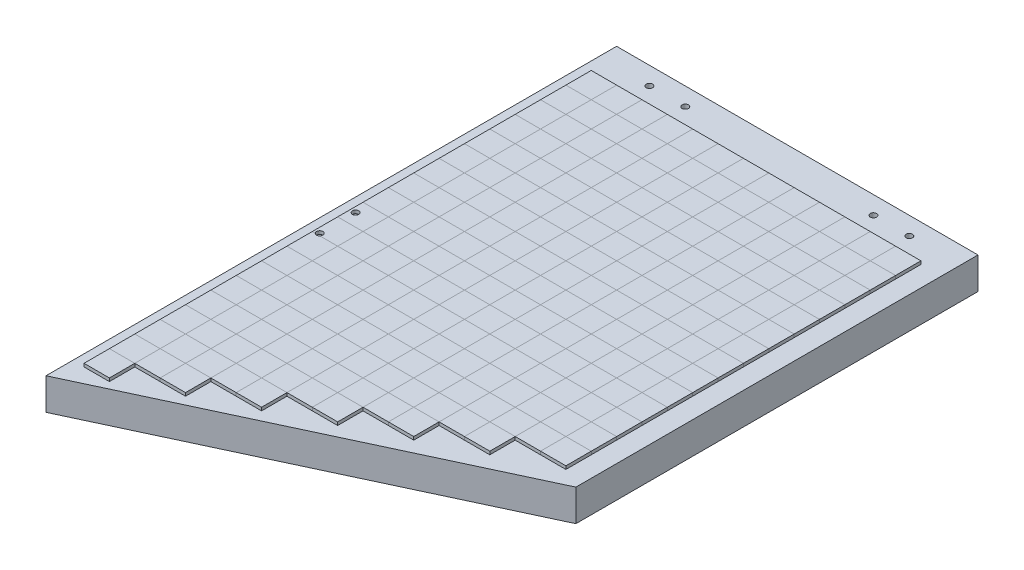
from build123d import *

# Parameters (mm, degrees)
BOSS_EXTRUDE1_DEPTH  = 63.5
SKETCH8_W            = 50.8
SKETCH8_H            = 50.8
BOSS_EXTRUDE2_DEPTH  = 6.35
LPATTERN1_COUNT      = 13
LPATTERN1_PITCH      = 50.8
LPATTERN1_COUNT_DIR2 = 20
LPATTERN1_PITCH_DIR2 = 50.8
CUT_EXTRUDE1_DEPTH   = 1205.933472064
CUT_EXTRUDE3_DEPTH   = 6.35
SKETCH13_R           = 6.35
CUT_EXTRUDE4_DEPTH   = 1205.933472064
SKETCH6_R            = 6.35
CUT_EXTRUDE5_DEPTH   = 1205.568653751


with BuildPart() as part:
    # Sketch1 → Boss-Extrude1 (new body)
    with BuildSketch(Plane(origin=(0, 0, 0), x_dir=(1, 0, 0), z_dir=(0, 1, 0))):
        Polygon((-349.5, 0), (374.4, 0), (374.4, -805.439886262), (-349.5, -1143), align=None)
    extrude(amount=BOSS_EXTRUDE1_DEPTH)


with BuildPart() as body_2:
    # Sketch8 → Boss-Extrude2 (new body)
    with BuildSketch(Plane(origin=(0, 66.04, 0), x_dir=(1, 0, 0), z_dir=(0, 1, 0))):
        with Locations((-298.7, -101.6)):
            Rectangle(SKETCH8_W, SKETCH8_H)
    boss_extrude2 = extrude(amount=BOSS_EXTRUDE2_DEPTH)


with BuildPart() as lpattern1_1:
    # LPattern1: pattern copy
    add(boss_extrude2.moved(Location(Vector(1, 0, 0) * (0 * LPATTERN1_PITCH) + Vector(0, 0, 1) * (1 * LPATTERN1_PITCH_DIR2))))


with BuildPart() as lpattern1_2:
    # LPattern1: pattern copy
    add(boss_extrude2.moved(Location(Vector(1, 0, 0) * (0 * LPATTERN1_PITCH) + Vector(0, 0, 1) * (2 * LPATTERN1_PITCH_DIR2))))


with BuildPart() as lpattern1_3:
    # LPattern1: pattern copy
    add(boss_extrude2.moved(Location(Vector(1, 0, 0) * (0 * LPATTERN1_PITCH) + Vector(0, 0, 1) * (3 * LPATTERN1_PITCH_DIR2))))


with BuildPart() as lpattern1_4:
    # LPattern1: pattern copy
    add(boss_extrude2.moved(Location(Vector(1, 0, 0) * (0 * LPATTERN1_PITCH) + Vector(0, 0, 1) * (4 * LPATTERN1_PITCH_DIR2))))


with BuildPart() as lpattern1_5:
    # LPattern1: pattern copy
    add(boss_extrude2.moved(Location(Vector(1, 0, 0) * (0 * LPATTERN1_PITCH) + Vector(0, 0, 1) * (5 * LPATTERN1_PITCH_DIR2))))


with BuildPart() as lpattern1_6:
    # LPattern1: pattern copy
    add(boss_extrude2.moved(Location(Vector(1, 0, 0) * (0 * LPATTERN1_PITCH) + Vector(0, 0, 1) * (6 * LPATTERN1_PITCH_DIR2))))


with BuildPart() as lpattern1_7:
    # LPattern1: pattern copy
    add(boss_extrude2.moved(Location(Vector(1, 0, 0) * (0 * LPATTERN1_PITCH) + Vector(0, 0, 1) * (7 * LPATTERN1_PITCH_DIR2))))


with BuildPart() as lpattern1_8:
    # LPattern1: pattern copy
    add(boss_extrude2.moved(Location(Vector(1, 0, 0) * (0 * LPATTERN1_PITCH) + Vector(0, 0, 1) * (8 * LPATTERN1_PITCH_DIR2))))


with BuildPart() as lpattern1_9:
    # LPattern1: pattern copy
    add(boss_extrude2.moved(Location(Vector(1, 0, 0) * (0 * LPATTERN1_PITCH) + Vector(0, 0, 1) * (9 * LPATTERN1_PITCH_DIR2))))


with BuildPart() as lpattern1_10:
    # LPattern1: pattern copy
    add(boss_extrude2.moved(Location(Vector(1, 0, 0) * (0 * LPATTERN1_PITCH) + Vector(0, 0, 1) * (10 * LPATTERN1_PITCH_DIR2))))


with BuildPart() as lpattern1_11:
    # LPattern1: pattern copy
    add(boss_extrude2.moved(Location(Vector(1, 0, 0) * (0 * LPATTERN1_PITCH) + Vector(0, 0, 1) * (11 * LPATTERN1_PITCH_DIR2))))


with BuildPart() as lpattern1_12:
    # LPattern1: pattern copy
    add(boss_extrude2.moved(Location(Vector(1, 0, 0) * (0 * LPATTERN1_PITCH) + Vector(0, 0, 1) * (12 * LPATTERN1_PITCH_DIR2))))


with BuildPart() as lpattern1_13:
    # LPattern1: pattern copy
    add(boss_extrude2.moved(Location(Vector(1, 0, 0) * (0 * LPATTERN1_PITCH) + Vector(0, 0, 1) * (13 * LPATTERN1_PITCH_DIR2))))


with BuildPart() as lpattern1_14:
    # LPattern1: pattern copy
    add(boss_extrude2.moved(Location(Vector(1, 0, 0) * (0 * LPATTERN1_PITCH) + Vector(0, 0, 1) * (14 * LPATTERN1_PITCH_DIR2))))


with BuildPart() as lpattern1_15:
    # LPattern1: pattern copy
    add(boss_extrude2.moved(Location(Vector(1, 0, 0) * (0 * LPATTERN1_PITCH) + Vector(0, 0, 1) * (15 * LPATTERN1_PITCH_DIR2))))


with BuildPart() as lpattern1_16:
    # LPattern1: pattern copy
    add(boss_extrude2.moved(Location(Vector(1, 0, 0) * (0 * LPATTERN1_PITCH) + Vector(0, 0, 1) * (16 * LPATTERN1_PITCH_DIR2))))


with BuildPart() as lpattern1_17:
    # LPattern1: pattern copy
    add(boss_extrude2.moved(Location(Vector(1, 0, 0) * (0 * LPATTERN1_PITCH) + Vector(0, 0, 1) * (17 * LPATTERN1_PITCH_DIR2))))


with BuildPart() as lpattern1_18:
    # LPattern1: pattern copy
    add(boss_extrude2.moved(Location(Vector(1, 0, 0) * (0 * LPATTERN1_PITCH) + Vector(0, 0, 1) * (18 * LPATTERN1_PITCH_DIR2))))


with BuildPart() as lpattern1_19:
    # LPattern1: pattern copy
    add(boss_extrude2.moved(Location(Vector(1, 0, 0) * (0 * LPATTERN1_PITCH) + Vector(0, 0, 1) * (19 * LPATTERN1_PITCH_DIR2))))


with BuildPart() as lpattern1_20:
    # LPattern1: pattern copy
    add(boss_extrude2.moved(Location(Vector(1, 0, 0) * (1 * LPATTERN1_PITCH) + Vector(0, 0, 1) * (0 * LPATTERN1_PITCH_DIR2))))


with BuildPart() as lpattern1_21:
    # LPattern1: pattern copy
    add(boss_extrude2.moved(Location(Vector(1, 0, 0) * (1 * LPATTERN1_PITCH) + Vector(0, 0, 1) * (1 * LPATTERN1_PITCH_DIR2))))


with BuildPart() as lpattern1_22:
    # LPattern1: pattern copy
    add(boss_extrude2.moved(Location(Vector(1, 0, 0) * (1 * LPATTERN1_PITCH) + Vector(0, 0, 1) * (2 * LPATTERN1_PITCH_DIR2))))


with BuildPart() as lpattern1_23:
    # LPattern1: pattern copy
    add(boss_extrude2.moved(Location(Vector(1, 0, 0) * (1 * LPATTERN1_PITCH) + Vector(0, 0, 1) * (3 * LPATTERN1_PITCH_DIR2))))


with BuildPart() as lpattern1_24:
    # LPattern1: pattern copy
    add(boss_extrude2.moved(Location(Vector(1, 0, 0) * (1 * LPATTERN1_PITCH) + Vector(0, 0, 1) * (4 * LPATTERN1_PITCH_DIR2))))


with BuildPart() as lpattern1_25:
    # LPattern1: pattern copy
    add(boss_extrude2.moved(Location(Vector(1, 0, 0) * (1 * LPATTERN1_PITCH) + Vector(0, 0, 1) * (5 * LPATTERN1_PITCH_DIR2))))


with BuildPart() as lpattern1_26:
    # LPattern1: pattern copy
    add(boss_extrude2.moved(Location(Vector(1, 0, 0) * (1 * LPATTERN1_PITCH) + Vector(0, 0, 1) * (6 * LPATTERN1_PITCH_DIR2))))


with BuildPart() as lpattern1_27:
    # LPattern1: pattern copy
    add(boss_extrude2.moved(Location(Vector(1, 0, 0) * (1 * LPATTERN1_PITCH) + Vector(0, 0, 1) * (7 * LPATTERN1_PITCH_DIR2))))


with BuildPart() as lpattern1_28:
    # LPattern1: pattern copy
    add(boss_extrude2.moved(Location(Vector(1, 0, 0) * (1 * LPATTERN1_PITCH) + Vector(0, 0, 1) * (8 * LPATTERN1_PITCH_DIR2))))


with BuildPart() as lpattern1_29:
    # LPattern1: pattern copy
    add(boss_extrude2.moved(Location(Vector(1, 0, 0) * (1 * LPATTERN1_PITCH) + Vector(0, 0, 1) * (9 * LPATTERN1_PITCH_DIR2))))


with BuildPart() as lpattern1_30:
    # LPattern1: pattern copy
    add(boss_extrude2.moved(Location(Vector(1, 0, 0) * (1 * LPATTERN1_PITCH) + Vector(0, 0, 1) * (10 * LPATTERN1_PITCH_DIR2))))


with BuildPart() as lpattern1_31:
    # LPattern1: pattern copy
    add(boss_extrude2.moved(Location(Vector(1, 0, 0) * (1 * LPATTERN1_PITCH) + Vector(0, 0, 1) * (11 * LPATTERN1_PITCH_DIR2))))


with BuildPart() as lpattern1_32:
    # LPattern1: pattern copy
    add(boss_extrude2.moved(Location(Vector(1, 0, 0) * (1 * LPATTERN1_PITCH) + Vector(0, 0, 1) * (12 * LPATTERN1_PITCH_DIR2))))


with BuildPart() as lpattern1_33:
    # LPattern1: pattern copy
    add(boss_extrude2.moved(Location(Vector(1, 0, 0) * (1 * LPATTERN1_PITCH) + Vector(0, 0, 1) * (13 * LPATTERN1_PITCH_DIR2))))


with BuildPart() as lpattern1_34:
    # LPattern1: pattern copy
    add(boss_extrude2.moved(Location(Vector(1, 0, 0) * (1 * LPATTERN1_PITCH) + Vector(0, 0, 1) * (14 * LPATTERN1_PITCH_DIR2))))


with BuildPart() as lpattern1_35:
    # LPattern1: pattern copy
    add(boss_extrude2.moved(Location(Vector(1, 0, 0) * (1 * LPATTERN1_PITCH) + Vector(0, 0, 1) * (15 * LPATTERN1_PITCH_DIR2))))


with BuildPart() as lpattern1_36:
    # LPattern1: pattern copy
    add(boss_extrude2.moved(Location(Vector(1, 0, 0) * (1 * LPATTERN1_PITCH) + Vector(0, 0, 1) * (16 * LPATTERN1_PITCH_DIR2))))


with BuildPart() as lpattern1_37:
    # LPattern1: pattern copy
    add(boss_extrude2.moved(Location(Vector(1, 0, 0) * (1 * LPATTERN1_PITCH) + Vector(0, 0, 1) * (17 * LPATTERN1_PITCH_DIR2))))


with BuildPart() as lpattern1_38:
    # LPattern1: pattern copy
    add(boss_extrude2.moved(Location(Vector(1, 0, 0) * (1 * LPATTERN1_PITCH) + Vector(0, 0, 1) * (18 * LPATTERN1_PITCH_DIR2))))


with BuildPart() as lpattern1_39:
    # LPattern1: pattern copy
    add(boss_extrude2.moved(Location(Vector(1, 0, 0) * (1 * LPATTERN1_PITCH) + Vector(0, 0, 1) * (19 * LPATTERN1_PITCH_DIR2))))


with BuildPart() as lpattern1_40:
    # LPattern1: pattern copy
    add(boss_extrude2.moved(Location(Vector(1, 0, 0) * (2 * LPATTERN1_PITCH) + Vector(0, 0, 1) * (0 * LPATTERN1_PITCH_DIR2))))


with BuildPart() as lpattern1_41:
    # LPattern1: pattern copy
    add(boss_extrude2.moved(Location(Vector(1, 0, 0) * (2 * LPATTERN1_PITCH) + Vector(0, 0, 1) * (1 * LPATTERN1_PITCH_DIR2))))


with BuildPart() as lpattern1_42:
    # LPattern1: pattern copy
    add(boss_extrude2.moved(Location(Vector(1, 0, 0) * (2 * LPATTERN1_PITCH) + Vector(0, 0, 1) * (2 * LPATTERN1_PITCH_DIR2))))


with BuildPart() as lpattern1_43:
    # LPattern1: pattern copy
    add(boss_extrude2.moved(Location(Vector(1, 0, 0) * (2 * LPATTERN1_PITCH) + Vector(0, 0, 1) * (3 * LPATTERN1_PITCH_DIR2))))


with BuildPart() as lpattern1_44:
    # LPattern1: pattern copy
    add(boss_extrude2.moved(Location(Vector(1, 0, 0) * (2 * LPATTERN1_PITCH) + Vector(0, 0, 1) * (4 * LPATTERN1_PITCH_DIR2))))


with BuildPart() as lpattern1_45:
    # LPattern1: pattern copy
    add(boss_extrude2.moved(Location(Vector(1, 0, 0) * (2 * LPATTERN1_PITCH) + Vector(0, 0, 1) * (5 * LPATTERN1_PITCH_DIR2))))


with BuildPart() as lpattern1_46:
    # LPattern1: pattern copy
    add(boss_extrude2.moved(Location(Vector(1, 0, 0) * (2 * LPATTERN1_PITCH) + Vector(0, 0, 1) * (6 * LPATTERN1_PITCH_DIR2))))


with BuildPart() as lpattern1_47:
    # LPattern1: pattern copy
    add(boss_extrude2.moved(Location(Vector(1, 0, 0) * (2 * LPATTERN1_PITCH) + Vector(0, 0, 1) * (7 * LPATTERN1_PITCH_DIR2))))


with BuildPart() as lpattern1_48:
    # LPattern1: pattern copy
    add(boss_extrude2.moved(Location(Vector(1, 0, 0) * (2 * LPATTERN1_PITCH) + Vector(0, 0, 1) * (8 * LPATTERN1_PITCH_DIR2))))


with BuildPart() as lpattern1_49:
    # LPattern1: pattern copy
    add(boss_extrude2.moved(Location(Vector(1, 0, 0) * (2 * LPATTERN1_PITCH) + Vector(0, 0, 1) * (9 * LPATTERN1_PITCH_DIR2))))


with BuildPart() as lpattern1_50:
    # LPattern1: pattern copy
    add(boss_extrude2.moved(Location(Vector(1, 0, 0) * (2 * LPATTERN1_PITCH) + Vector(0, 0, 1) * (10 * LPATTERN1_PITCH_DIR2))))


with BuildPart() as lpattern1_51:
    # LPattern1: pattern copy
    add(boss_extrude2.moved(Location(Vector(1, 0, 0) * (2 * LPATTERN1_PITCH) + Vector(0, 0, 1) * (11 * LPATTERN1_PITCH_DIR2))))


with BuildPart() as lpattern1_52:
    # LPattern1: pattern copy
    add(boss_extrude2.moved(Location(Vector(1, 0, 0) * (2 * LPATTERN1_PITCH) + Vector(0, 0, 1) * (12 * LPATTERN1_PITCH_DIR2))))


with BuildPart() as lpattern1_53:
    # LPattern1: pattern copy
    add(boss_extrude2.moved(Location(Vector(1, 0, 0) * (2 * LPATTERN1_PITCH) + Vector(0, 0, 1) * (13 * LPATTERN1_PITCH_DIR2))))


with BuildPart() as lpattern1_54:
    # LPattern1: pattern copy
    add(boss_extrude2.moved(Location(Vector(1, 0, 0) * (2 * LPATTERN1_PITCH) + Vector(0, 0, 1) * (14 * LPATTERN1_PITCH_DIR2))))


with BuildPart() as lpattern1_55:
    # LPattern1: pattern copy
    add(boss_extrude2.moved(Location(Vector(1, 0, 0) * (2 * LPATTERN1_PITCH) + Vector(0, 0, 1) * (15 * LPATTERN1_PITCH_DIR2))))


with BuildPart() as lpattern1_56:
    # LPattern1: pattern copy
    add(boss_extrude2.moved(Location(Vector(1, 0, 0) * (2 * LPATTERN1_PITCH) + Vector(0, 0, 1) * (16 * LPATTERN1_PITCH_DIR2))))


with BuildPart() as lpattern1_57:
    # LPattern1: pattern copy
    add(boss_extrude2.moved(Location(Vector(1, 0, 0) * (2 * LPATTERN1_PITCH) + Vector(0, 0, 1) * (17 * LPATTERN1_PITCH_DIR2))))


with BuildPart() as lpattern1_58:
    # LPattern1: pattern copy
    add(boss_extrude2.moved(Location(Vector(1, 0, 0) * (2 * LPATTERN1_PITCH) + Vector(0, 0, 1) * (18 * LPATTERN1_PITCH_DIR2))))


with BuildPart() as lpattern1_59:
    # LPattern1: pattern copy
    add(boss_extrude2.moved(Location(Vector(1, 0, 0) * (2 * LPATTERN1_PITCH) + Vector(0, 0, 1) * (19 * LPATTERN1_PITCH_DIR2))))


with BuildPart() as lpattern1_60:
    # LPattern1: pattern copy
    add(boss_extrude2.moved(Location(Vector(1, 0, 0) * (3 * LPATTERN1_PITCH) + Vector(0, 0, 1) * (0 * LPATTERN1_PITCH_DIR2))))


with BuildPart() as lpattern1_61:
    # LPattern1: pattern copy
    add(boss_extrude2.moved(Location(Vector(1, 0, 0) * (3 * LPATTERN1_PITCH) + Vector(0, 0, 1) * (1 * LPATTERN1_PITCH_DIR2))))


with BuildPart() as lpattern1_62:
    # LPattern1: pattern copy
    add(boss_extrude2.moved(Location(Vector(1, 0, 0) * (3 * LPATTERN1_PITCH) + Vector(0, 0, 1) * (2 * LPATTERN1_PITCH_DIR2))))


with BuildPart() as lpattern1_63:
    # LPattern1: pattern copy
    add(boss_extrude2.moved(Location(Vector(1, 0, 0) * (3 * LPATTERN1_PITCH) + Vector(0, 0, 1) * (3 * LPATTERN1_PITCH_DIR2))))


with BuildPart() as lpattern1_64:
    # LPattern1: pattern copy
    add(boss_extrude2.moved(Location(Vector(1, 0, 0) * (3 * LPATTERN1_PITCH) + Vector(0, 0, 1) * (4 * LPATTERN1_PITCH_DIR2))))


with BuildPart() as lpattern1_65:
    # LPattern1: pattern copy
    add(boss_extrude2.moved(Location(Vector(1, 0, 0) * (3 * LPATTERN1_PITCH) + Vector(0, 0, 1) * (5 * LPATTERN1_PITCH_DIR2))))


with BuildPart() as lpattern1_66:
    # LPattern1: pattern copy
    add(boss_extrude2.moved(Location(Vector(1, 0, 0) * (3 * LPATTERN1_PITCH) + Vector(0, 0, 1) * (6 * LPATTERN1_PITCH_DIR2))))


with BuildPart() as lpattern1_67:
    # LPattern1: pattern copy
    add(boss_extrude2.moved(Location(Vector(1, 0, 0) * (3 * LPATTERN1_PITCH) + Vector(0, 0, 1) * (7 * LPATTERN1_PITCH_DIR2))))


with BuildPart() as lpattern1_68:
    # LPattern1: pattern copy
    add(boss_extrude2.moved(Location(Vector(1, 0, 0) * (3 * LPATTERN1_PITCH) + Vector(0, 0, 1) * (8 * LPATTERN1_PITCH_DIR2))))


with BuildPart() as lpattern1_69:
    # LPattern1: pattern copy
    add(boss_extrude2.moved(Location(Vector(1, 0, 0) * (3 * LPATTERN1_PITCH) + Vector(0, 0, 1) * (9 * LPATTERN1_PITCH_DIR2))))


with BuildPart() as lpattern1_70:
    # LPattern1: pattern copy
    add(boss_extrude2.moved(Location(Vector(1, 0, 0) * (3 * LPATTERN1_PITCH) + Vector(0, 0, 1) * (10 * LPATTERN1_PITCH_DIR2))))


with BuildPart() as lpattern1_71:
    # LPattern1: pattern copy
    add(boss_extrude2.moved(Location(Vector(1, 0, 0) * (3 * LPATTERN1_PITCH) + Vector(0, 0, 1) * (11 * LPATTERN1_PITCH_DIR2))))


with BuildPart() as lpattern1_72:
    # LPattern1: pattern copy
    add(boss_extrude2.moved(Location(Vector(1, 0, 0) * (3 * LPATTERN1_PITCH) + Vector(0, 0, 1) * (12 * LPATTERN1_PITCH_DIR2))))


with BuildPart() as lpattern1_73:
    # LPattern1: pattern copy
    add(boss_extrude2.moved(Location(Vector(1, 0, 0) * (3 * LPATTERN1_PITCH) + Vector(0, 0, 1) * (13 * LPATTERN1_PITCH_DIR2))))


with BuildPart() as lpattern1_74:
    # LPattern1: pattern copy
    add(boss_extrude2.moved(Location(Vector(1, 0, 0) * (3 * LPATTERN1_PITCH) + Vector(0, 0, 1) * (14 * LPATTERN1_PITCH_DIR2))))


with BuildPart() as lpattern1_75:
    # LPattern1: pattern copy
    add(boss_extrude2.moved(Location(Vector(1, 0, 0) * (3 * LPATTERN1_PITCH) + Vector(0, 0, 1) * (15 * LPATTERN1_PITCH_DIR2))))


with BuildPart() as lpattern1_76:
    # LPattern1: pattern copy
    add(boss_extrude2.moved(Location(Vector(1, 0, 0) * (3 * LPATTERN1_PITCH) + Vector(0, 0, 1) * (16 * LPATTERN1_PITCH_DIR2))))


with BuildPart() as lpattern1_77:
    # LPattern1: pattern copy
    add(boss_extrude2.moved(Location(Vector(1, 0, 0) * (3 * LPATTERN1_PITCH) + Vector(0, 0, 1) * (17 * LPATTERN1_PITCH_DIR2))))


with BuildPart() as lpattern1_78:
    # LPattern1: pattern copy
    add(boss_extrude2.moved(Location(Vector(1, 0, 0) * (3 * LPATTERN1_PITCH) + Vector(0, 0, 1) * (18 * LPATTERN1_PITCH_DIR2))))


with BuildPart() as lpattern1_79:
    # LPattern1: pattern copy
    add(boss_extrude2.moved(Location(Vector(1, 0, 0) * (3 * LPATTERN1_PITCH) + Vector(0, 0, 1) * (19 * LPATTERN1_PITCH_DIR2))))


with BuildPart() as lpattern1_80:
    # LPattern1: pattern copy
    add(boss_extrude2.moved(Location(Vector(1, 0, 0) * (4 * LPATTERN1_PITCH) + Vector(0, 0, 1) * (0 * LPATTERN1_PITCH_DIR2))))


with BuildPart() as lpattern1_81:
    # LPattern1: pattern copy
    add(boss_extrude2.moved(Location(Vector(1, 0, 0) * (4 * LPATTERN1_PITCH) + Vector(0, 0, 1) * (1 * LPATTERN1_PITCH_DIR2))))


with BuildPart() as lpattern1_82:
    # LPattern1: pattern copy
    add(boss_extrude2.moved(Location(Vector(1, 0, 0) * (4 * LPATTERN1_PITCH) + Vector(0, 0, 1) * (2 * LPATTERN1_PITCH_DIR2))))


with BuildPart() as lpattern1_83:
    # LPattern1: pattern copy
    add(boss_extrude2.moved(Location(Vector(1, 0, 0) * (4 * LPATTERN1_PITCH) + Vector(0, 0, 1) * (3 * LPATTERN1_PITCH_DIR2))))


with BuildPart() as lpattern1_84:
    # LPattern1: pattern copy
    add(boss_extrude2.moved(Location(Vector(1, 0, 0) * (4 * LPATTERN1_PITCH) + Vector(0, 0, 1) * (4 * LPATTERN1_PITCH_DIR2))))


with BuildPart() as lpattern1_85:
    # LPattern1: pattern copy
    add(boss_extrude2.moved(Location(Vector(1, 0, 0) * (4 * LPATTERN1_PITCH) + Vector(0, 0, 1) * (5 * LPATTERN1_PITCH_DIR2))))


with BuildPart() as lpattern1_86:
    # LPattern1: pattern copy
    add(boss_extrude2.moved(Location(Vector(1, 0, 0) * (4 * LPATTERN1_PITCH) + Vector(0, 0, 1) * (6 * LPATTERN1_PITCH_DIR2))))


with BuildPart() as lpattern1_87:
    # LPattern1: pattern copy
    add(boss_extrude2.moved(Location(Vector(1, 0, 0) * (4 * LPATTERN1_PITCH) + Vector(0, 0, 1) * (7 * LPATTERN1_PITCH_DIR2))))


with BuildPart() as lpattern1_88:
    # LPattern1: pattern copy
    add(boss_extrude2.moved(Location(Vector(1, 0, 0) * (4 * LPATTERN1_PITCH) + Vector(0, 0, 1) * (8 * LPATTERN1_PITCH_DIR2))))


with BuildPart() as lpattern1_89:
    # LPattern1: pattern copy
    add(boss_extrude2.moved(Location(Vector(1, 0, 0) * (4 * LPATTERN1_PITCH) + Vector(0, 0, 1) * (9 * LPATTERN1_PITCH_DIR2))))


with BuildPart() as lpattern1_90:
    # LPattern1: pattern copy
    add(boss_extrude2.moved(Location(Vector(1, 0, 0) * (4 * LPATTERN1_PITCH) + Vector(0, 0, 1) * (10 * LPATTERN1_PITCH_DIR2))))


with BuildPart() as lpattern1_91:
    # LPattern1: pattern copy
    add(boss_extrude2.moved(Location(Vector(1, 0, 0) * (4 * LPATTERN1_PITCH) + Vector(0, 0, 1) * (11 * LPATTERN1_PITCH_DIR2))))


with BuildPart() as lpattern1_92:
    # LPattern1: pattern copy
    add(boss_extrude2.moved(Location(Vector(1, 0, 0) * (4 * LPATTERN1_PITCH) + Vector(0, 0, 1) * (12 * LPATTERN1_PITCH_DIR2))))


with BuildPart() as lpattern1_93:
    # LPattern1: pattern copy
    add(boss_extrude2.moved(Location(Vector(1, 0, 0) * (4 * LPATTERN1_PITCH) + Vector(0, 0, 1) * (13 * LPATTERN1_PITCH_DIR2))))


with BuildPart() as lpattern1_94:
    # LPattern1: pattern copy
    add(boss_extrude2.moved(Location(Vector(1, 0, 0) * (4 * LPATTERN1_PITCH) + Vector(0, 0, 1) * (14 * LPATTERN1_PITCH_DIR2))))


with BuildPart() as lpattern1_95:
    # LPattern1: pattern copy
    add(boss_extrude2.moved(Location(Vector(1, 0, 0) * (4 * LPATTERN1_PITCH) + Vector(0, 0, 1) * (15 * LPATTERN1_PITCH_DIR2))))


with BuildPart() as lpattern1_96:
    # LPattern1: pattern copy
    add(boss_extrude2.moved(Location(Vector(1, 0, 0) * (4 * LPATTERN1_PITCH) + Vector(0, 0, 1) * (16 * LPATTERN1_PITCH_DIR2))))


with BuildPart() as lpattern1_97:
    # LPattern1: pattern copy
    add(boss_extrude2.moved(Location(Vector(1, 0, 0) * (4 * LPATTERN1_PITCH) + Vector(0, 0, 1) * (17 * LPATTERN1_PITCH_DIR2))))


with BuildPart() as lpattern1_98:
    # LPattern1: pattern copy
    add(boss_extrude2.moved(Location(Vector(1, 0, 0) * (4 * LPATTERN1_PITCH) + Vector(0, 0, 1) * (18 * LPATTERN1_PITCH_DIR2))))


with BuildPart() as lpattern1_99:
    # LPattern1: pattern copy
    add(boss_extrude2.moved(Location(Vector(1, 0, 0) * (4 * LPATTERN1_PITCH) + Vector(0, 0, 1) * (19 * LPATTERN1_PITCH_DIR2))))


with BuildPart() as lpattern1_100:
    # LPattern1: pattern copy
    add(boss_extrude2.moved(Location(Vector(1, 0, 0) * (5 * LPATTERN1_PITCH) + Vector(0, 0, 1) * (0 * LPATTERN1_PITCH_DIR2))))


with BuildPart() as lpattern1_101:
    # LPattern1: pattern copy
    add(boss_extrude2.moved(Location(Vector(1, 0, 0) * (5 * LPATTERN1_PITCH) + Vector(0, 0, 1) * (1 * LPATTERN1_PITCH_DIR2))))


with BuildPart() as lpattern1_102:
    # LPattern1: pattern copy
    add(boss_extrude2.moved(Location(Vector(1, 0, 0) * (5 * LPATTERN1_PITCH) + Vector(0, 0, 1) * (2 * LPATTERN1_PITCH_DIR2))))


with BuildPart() as lpattern1_103:
    # LPattern1: pattern copy
    add(boss_extrude2.moved(Location(Vector(1, 0, 0) * (5 * LPATTERN1_PITCH) + Vector(0, 0, 1) * (3 * LPATTERN1_PITCH_DIR2))))


with BuildPart() as lpattern1_104:
    # LPattern1: pattern copy
    add(boss_extrude2.moved(Location(Vector(1, 0, 0) * (5 * LPATTERN1_PITCH) + Vector(0, 0, 1) * (4 * LPATTERN1_PITCH_DIR2))))


with BuildPart() as lpattern1_105:
    # LPattern1: pattern copy
    add(boss_extrude2.moved(Location(Vector(1, 0, 0) * (5 * LPATTERN1_PITCH) + Vector(0, 0, 1) * (5 * LPATTERN1_PITCH_DIR2))))


with BuildPart() as lpattern1_106:
    # LPattern1: pattern copy
    add(boss_extrude2.moved(Location(Vector(1, 0, 0) * (5 * LPATTERN1_PITCH) + Vector(0, 0, 1) * (6 * LPATTERN1_PITCH_DIR2))))


with BuildPart() as lpattern1_107:
    # LPattern1: pattern copy
    add(boss_extrude2.moved(Location(Vector(1, 0, 0) * (5 * LPATTERN1_PITCH) + Vector(0, 0, 1) * (7 * LPATTERN1_PITCH_DIR2))))


with BuildPart() as lpattern1_108:
    # LPattern1: pattern copy
    add(boss_extrude2.moved(Location(Vector(1, 0, 0) * (5 * LPATTERN1_PITCH) + Vector(0, 0, 1) * (8 * LPATTERN1_PITCH_DIR2))))


with BuildPart() as lpattern1_109:
    # LPattern1: pattern copy
    add(boss_extrude2.moved(Location(Vector(1, 0, 0) * (5 * LPATTERN1_PITCH) + Vector(0, 0, 1) * (9 * LPATTERN1_PITCH_DIR2))))


with BuildPart() as lpattern1_110:
    # LPattern1: pattern copy
    add(boss_extrude2.moved(Location(Vector(1, 0, 0) * (5 * LPATTERN1_PITCH) + Vector(0, 0, 1) * (10 * LPATTERN1_PITCH_DIR2))))


with BuildPart() as lpattern1_111:
    # LPattern1: pattern copy
    add(boss_extrude2.moved(Location(Vector(1, 0, 0) * (5 * LPATTERN1_PITCH) + Vector(0, 0, 1) * (11 * LPATTERN1_PITCH_DIR2))))


with BuildPart() as lpattern1_112:
    # LPattern1: pattern copy
    add(boss_extrude2.moved(Location(Vector(1, 0, 0) * (5 * LPATTERN1_PITCH) + Vector(0, 0, 1) * (12 * LPATTERN1_PITCH_DIR2))))


with BuildPart() as lpattern1_113:
    # LPattern1: pattern copy
    add(boss_extrude2.moved(Location(Vector(1, 0, 0) * (5 * LPATTERN1_PITCH) + Vector(0, 0, 1) * (13 * LPATTERN1_PITCH_DIR2))))


with BuildPart() as lpattern1_114:
    # LPattern1: pattern copy
    add(boss_extrude2.moved(Location(Vector(1, 0, 0) * (5 * LPATTERN1_PITCH) + Vector(0, 0, 1) * (14 * LPATTERN1_PITCH_DIR2))))


with BuildPart() as lpattern1_115:
    # LPattern1: pattern copy
    add(boss_extrude2.moved(Location(Vector(1, 0, 0) * (5 * LPATTERN1_PITCH) + Vector(0, 0, 1) * (15 * LPATTERN1_PITCH_DIR2))))


with BuildPart() as lpattern1_116:
    # LPattern1: pattern copy
    add(boss_extrude2.moved(Location(Vector(1, 0, 0) * (5 * LPATTERN1_PITCH) + Vector(0, 0, 1) * (16 * LPATTERN1_PITCH_DIR2))))


with BuildPart() as lpattern1_117:
    # LPattern1: pattern copy
    add(boss_extrude2.moved(Location(Vector(1, 0, 0) * (5 * LPATTERN1_PITCH) + Vector(0, 0, 1) * (17 * LPATTERN1_PITCH_DIR2))))


with BuildPart() as lpattern1_118:
    # LPattern1: pattern copy
    add(boss_extrude2.moved(Location(Vector(1, 0, 0) * (5 * LPATTERN1_PITCH) + Vector(0, 0, 1) * (18 * LPATTERN1_PITCH_DIR2))))


with BuildPart() as lpattern1_119:
    # LPattern1: pattern copy
    add(boss_extrude2.moved(Location(Vector(1, 0, 0) * (5 * LPATTERN1_PITCH) + Vector(0, 0, 1) * (19 * LPATTERN1_PITCH_DIR2))))


with BuildPart() as lpattern1_120:
    # LPattern1: pattern copy
    add(boss_extrude2.moved(Location(Vector(1, 0, 0) * (6 * LPATTERN1_PITCH) + Vector(0, 0, 1) * (0 * LPATTERN1_PITCH_DIR2))))


with BuildPart() as lpattern1_121:
    # LPattern1: pattern copy
    add(boss_extrude2.moved(Location(Vector(1, 0, 0) * (6 * LPATTERN1_PITCH) + Vector(0, 0, 1) * (1 * LPATTERN1_PITCH_DIR2))))


with BuildPart() as lpattern1_122:
    # LPattern1: pattern copy
    add(boss_extrude2.moved(Location(Vector(1, 0, 0) * (6 * LPATTERN1_PITCH) + Vector(0, 0, 1) * (2 * LPATTERN1_PITCH_DIR2))))


with BuildPart() as lpattern1_123:
    # LPattern1: pattern copy
    add(boss_extrude2.moved(Location(Vector(1, 0, 0) * (6 * LPATTERN1_PITCH) + Vector(0, 0, 1) * (3 * LPATTERN1_PITCH_DIR2))))


with BuildPart() as lpattern1_124:
    # LPattern1: pattern copy
    add(boss_extrude2.moved(Location(Vector(1, 0, 0) * (6 * LPATTERN1_PITCH) + Vector(0, 0, 1) * (4 * LPATTERN1_PITCH_DIR2))))


with BuildPart() as lpattern1_125:
    # LPattern1: pattern copy
    add(boss_extrude2.moved(Location(Vector(1, 0, 0) * (6 * LPATTERN1_PITCH) + Vector(0, 0, 1) * (5 * LPATTERN1_PITCH_DIR2))))


with BuildPart() as lpattern1_126:
    # LPattern1: pattern copy
    add(boss_extrude2.moved(Location(Vector(1, 0, 0) * (6 * LPATTERN1_PITCH) + Vector(0, 0, 1) * (6 * LPATTERN1_PITCH_DIR2))))


with BuildPart() as lpattern1_127:
    # LPattern1: pattern copy
    add(boss_extrude2.moved(Location(Vector(1, 0, 0) * (6 * LPATTERN1_PITCH) + Vector(0, 0, 1) * (7 * LPATTERN1_PITCH_DIR2))))


with BuildPart() as lpattern1_128:
    # LPattern1: pattern copy
    add(boss_extrude2.moved(Location(Vector(1, 0, 0) * (6 * LPATTERN1_PITCH) + Vector(0, 0, 1) * (8 * LPATTERN1_PITCH_DIR2))))


with BuildPart() as lpattern1_129:
    # LPattern1: pattern copy
    add(boss_extrude2.moved(Location(Vector(1, 0, 0) * (6 * LPATTERN1_PITCH) + Vector(0, 0, 1) * (9 * LPATTERN1_PITCH_DIR2))))


with BuildPart() as lpattern1_130:
    # LPattern1: pattern copy
    add(boss_extrude2.moved(Location(Vector(1, 0, 0) * (6 * LPATTERN1_PITCH) + Vector(0, 0, 1) * (10 * LPATTERN1_PITCH_DIR2))))


with BuildPart() as lpattern1_131:
    # LPattern1: pattern copy
    add(boss_extrude2.moved(Location(Vector(1, 0, 0) * (6 * LPATTERN1_PITCH) + Vector(0, 0, 1) * (11 * LPATTERN1_PITCH_DIR2))))


with BuildPart() as lpattern1_132:
    # LPattern1: pattern copy
    add(boss_extrude2.moved(Location(Vector(1, 0, 0) * (6 * LPATTERN1_PITCH) + Vector(0, 0, 1) * (12 * LPATTERN1_PITCH_DIR2))))


with BuildPart() as lpattern1_133:
    # LPattern1: pattern copy
    add(boss_extrude2.moved(Location(Vector(1, 0, 0) * (6 * LPATTERN1_PITCH) + Vector(0, 0, 1) * (13 * LPATTERN1_PITCH_DIR2))))


with BuildPart() as lpattern1_134:
    # LPattern1: pattern copy
    add(boss_extrude2.moved(Location(Vector(1, 0, 0) * (6 * LPATTERN1_PITCH) + Vector(0, 0, 1) * (14 * LPATTERN1_PITCH_DIR2))))


with BuildPart() as lpattern1_135:
    # LPattern1: pattern copy
    add(boss_extrude2.moved(Location(Vector(1, 0, 0) * (6 * LPATTERN1_PITCH) + Vector(0, 0, 1) * (15 * LPATTERN1_PITCH_DIR2))))


with BuildPart() as lpattern1_136:
    # LPattern1: pattern copy
    add(boss_extrude2.moved(Location(Vector(1, 0, 0) * (6 * LPATTERN1_PITCH) + Vector(0, 0, 1) * (16 * LPATTERN1_PITCH_DIR2))))


with BuildPart() as lpattern1_137:
    # LPattern1: pattern copy
    add(boss_extrude2.moved(Location(Vector(1, 0, 0) * (6 * LPATTERN1_PITCH) + Vector(0, 0, 1) * (17 * LPATTERN1_PITCH_DIR2))))


with BuildPart() as lpattern1_138:
    # LPattern1: pattern copy
    add(boss_extrude2.moved(Location(Vector(1, 0, 0) * (6 * LPATTERN1_PITCH) + Vector(0, 0, 1) * (18 * LPATTERN1_PITCH_DIR2))))


with BuildPart() as lpattern1_139:
    # LPattern1: pattern copy
    add(boss_extrude2.moved(Location(Vector(1, 0, 0) * (6 * LPATTERN1_PITCH) + Vector(0, 0, 1) * (19 * LPATTERN1_PITCH_DIR2))))


with BuildPart() as lpattern1_140:
    # LPattern1: pattern copy
    add(boss_extrude2.moved(Location(Vector(1, 0, 0) * (7 * LPATTERN1_PITCH) + Vector(0, 0, 1) * (0 * LPATTERN1_PITCH_DIR2))))


with BuildPart() as lpattern1_141:
    # LPattern1: pattern copy
    add(boss_extrude2.moved(Location(Vector(1, 0, 0) * (7 * LPATTERN1_PITCH) + Vector(0, 0, 1) * (1 * LPATTERN1_PITCH_DIR2))))


with BuildPart() as lpattern1_142:
    # LPattern1: pattern copy
    add(boss_extrude2.moved(Location(Vector(1, 0, 0) * (7 * LPATTERN1_PITCH) + Vector(0, 0, 1) * (2 * LPATTERN1_PITCH_DIR2))))


with BuildPart() as lpattern1_143:
    # LPattern1: pattern copy
    add(boss_extrude2.moved(Location(Vector(1, 0, 0) * (7 * LPATTERN1_PITCH) + Vector(0, 0, 1) * (3 * LPATTERN1_PITCH_DIR2))))


with BuildPart() as lpattern1_144:
    # LPattern1: pattern copy
    add(boss_extrude2.moved(Location(Vector(1, 0, 0) * (7 * LPATTERN1_PITCH) + Vector(0, 0, 1) * (4 * LPATTERN1_PITCH_DIR2))))


with BuildPart() as lpattern1_145:
    # LPattern1: pattern copy
    add(boss_extrude2.moved(Location(Vector(1, 0, 0) * (7 * LPATTERN1_PITCH) + Vector(0, 0, 1) * (5 * LPATTERN1_PITCH_DIR2))))


with BuildPart() as lpattern1_146:
    # LPattern1: pattern copy
    add(boss_extrude2.moved(Location(Vector(1, 0, 0) * (7 * LPATTERN1_PITCH) + Vector(0, 0, 1) * (6 * LPATTERN1_PITCH_DIR2))))


with BuildPart() as lpattern1_147:
    # LPattern1: pattern copy
    add(boss_extrude2.moved(Location(Vector(1, 0, 0) * (7 * LPATTERN1_PITCH) + Vector(0, 0, 1) * (7 * LPATTERN1_PITCH_DIR2))))


with BuildPart() as lpattern1_148:
    # LPattern1: pattern copy
    add(boss_extrude2.moved(Location(Vector(1, 0, 0) * (7 * LPATTERN1_PITCH) + Vector(0, 0, 1) * (8 * LPATTERN1_PITCH_DIR2))))


with BuildPart() as lpattern1_149:
    # LPattern1: pattern copy
    add(boss_extrude2.moved(Location(Vector(1, 0, 0) * (7 * LPATTERN1_PITCH) + Vector(0, 0, 1) * (9 * LPATTERN1_PITCH_DIR2))))


with BuildPart() as lpattern1_150:
    # LPattern1: pattern copy
    add(boss_extrude2.moved(Location(Vector(1, 0, 0) * (7 * LPATTERN1_PITCH) + Vector(0, 0, 1) * (10 * LPATTERN1_PITCH_DIR2))))


with BuildPart() as lpattern1_151:
    # LPattern1: pattern copy
    add(boss_extrude2.moved(Location(Vector(1, 0, 0) * (7 * LPATTERN1_PITCH) + Vector(0, 0, 1) * (11 * LPATTERN1_PITCH_DIR2))))


with BuildPart() as lpattern1_152:
    # LPattern1: pattern copy
    add(boss_extrude2.moved(Location(Vector(1, 0, 0) * (7 * LPATTERN1_PITCH) + Vector(0, 0, 1) * (12 * LPATTERN1_PITCH_DIR2))))


with BuildPart() as lpattern1_153:
    # LPattern1: pattern copy
    add(boss_extrude2.moved(Location(Vector(1, 0, 0) * (7 * LPATTERN1_PITCH) + Vector(0, 0, 1) * (13 * LPATTERN1_PITCH_DIR2))))


with BuildPart() as lpattern1_154:
    # LPattern1: pattern copy
    add(boss_extrude2.moved(Location(Vector(1, 0, 0) * (7 * LPATTERN1_PITCH) + Vector(0, 0, 1) * (14 * LPATTERN1_PITCH_DIR2))))


with BuildPart() as lpattern1_155:
    # LPattern1: pattern copy
    add(boss_extrude2.moved(Location(Vector(1, 0, 0) * (7 * LPATTERN1_PITCH) + Vector(0, 0, 1) * (15 * LPATTERN1_PITCH_DIR2))))


with BuildPart() as lpattern1_156:
    # LPattern1: pattern copy
    add(boss_extrude2.moved(Location(Vector(1, 0, 0) * (7 * LPATTERN1_PITCH) + Vector(0, 0, 1) * (16 * LPATTERN1_PITCH_DIR2))))


with BuildPart() as lpattern1_157:
    # LPattern1: pattern copy
    add(boss_extrude2.moved(Location(Vector(1, 0, 0) * (7 * LPATTERN1_PITCH) + Vector(0, 0, 1) * (17 * LPATTERN1_PITCH_DIR2))))


with BuildPart() as lpattern1_158:
    # LPattern1: pattern copy
    add(boss_extrude2.moved(Location(Vector(1, 0, 0) * (7 * LPATTERN1_PITCH) + Vector(0, 0, 1) * (18 * LPATTERN1_PITCH_DIR2))))


with BuildPart() as lpattern1_159:
    # LPattern1: pattern copy
    add(boss_extrude2.moved(Location(Vector(1, 0, 0) * (7 * LPATTERN1_PITCH) + Vector(0, 0, 1) * (19 * LPATTERN1_PITCH_DIR2))))


with BuildPart() as lpattern1_160:
    # LPattern1: pattern copy
    add(boss_extrude2.moved(Location(Vector(1, 0, 0) * (8 * LPATTERN1_PITCH) + Vector(0, 0, 1) * (0 * LPATTERN1_PITCH_DIR2))))


with BuildPart() as lpattern1_161:
    # LPattern1: pattern copy
    add(boss_extrude2.moved(Location(Vector(1, 0, 0) * (8 * LPATTERN1_PITCH) + Vector(0, 0, 1) * (1 * LPATTERN1_PITCH_DIR2))))


with BuildPart() as lpattern1_162:
    # LPattern1: pattern copy
    add(boss_extrude2.moved(Location(Vector(1, 0, 0) * (8 * LPATTERN1_PITCH) + Vector(0, 0, 1) * (2 * LPATTERN1_PITCH_DIR2))))


with BuildPart() as lpattern1_163:
    # LPattern1: pattern copy
    add(boss_extrude2.moved(Location(Vector(1, 0, 0) * (8 * LPATTERN1_PITCH) + Vector(0, 0, 1) * (3 * LPATTERN1_PITCH_DIR2))))


with BuildPart() as lpattern1_164:
    # LPattern1: pattern copy
    add(boss_extrude2.moved(Location(Vector(1, 0, 0) * (8 * LPATTERN1_PITCH) + Vector(0, 0, 1) * (4 * LPATTERN1_PITCH_DIR2))))


with BuildPart() as lpattern1_165:
    # LPattern1: pattern copy
    add(boss_extrude2.moved(Location(Vector(1, 0, 0) * (8 * LPATTERN1_PITCH) + Vector(0, 0, 1) * (5 * LPATTERN1_PITCH_DIR2))))


with BuildPart() as lpattern1_166:
    # LPattern1: pattern copy
    add(boss_extrude2.moved(Location(Vector(1, 0, 0) * (8 * LPATTERN1_PITCH) + Vector(0, 0, 1) * (6 * LPATTERN1_PITCH_DIR2))))


with BuildPart() as lpattern1_167:
    # LPattern1: pattern copy
    add(boss_extrude2.moved(Location(Vector(1, 0, 0) * (8 * LPATTERN1_PITCH) + Vector(0, 0, 1) * (7 * LPATTERN1_PITCH_DIR2))))


with BuildPart() as lpattern1_168:
    # LPattern1: pattern copy
    add(boss_extrude2.moved(Location(Vector(1, 0, 0) * (8 * LPATTERN1_PITCH) + Vector(0, 0, 1) * (8 * LPATTERN1_PITCH_DIR2))))


with BuildPart() as lpattern1_169:
    # LPattern1: pattern copy
    add(boss_extrude2.moved(Location(Vector(1, 0, 0) * (8 * LPATTERN1_PITCH) + Vector(0, 0, 1) * (9 * LPATTERN1_PITCH_DIR2))))


with BuildPart() as lpattern1_170:
    # LPattern1: pattern copy
    add(boss_extrude2.moved(Location(Vector(1, 0, 0) * (8 * LPATTERN1_PITCH) + Vector(0, 0, 1) * (10 * LPATTERN1_PITCH_DIR2))))


with BuildPart() as lpattern1_171:
    # LPattern1: pattern copy
    add(boss_extrude2.moved(Location(Vector(1, 0, 0) * (8 * LPATTERN1_PITCH) + Vector(0, 0, 1) * (11 * LPATTERN1_PITCH_DIR2))))


with BuildPart() as lpattern1_172:
    # LPattern1: pattern copy
    add(boss_extrude2.moved(Location(Vector(1, 0, 0) * (8 * LPATTERN1_PITCH) + Vector(0, 0, 1) * (12 * LPATTERN1_PITCH_DIR2))))


with BuildPart() as lpattern1_173:
    # LPattern1: pattern copy
    add(boss_extrude2.moved(Location(Vector(1, 0, 0) * (8 * LPATTERN1_PITCH) + Vector(0, 0, 1) * (13 * LPATTERN1_PITCH_DIR2))))


with BuildPart() as lpattern1_174:
    # LPattern1: pattern copy
    add(boss_extrude2.moved(Location(Vector(1, 0, 0) * (8 * LPATTERN1_PITCH) + Vector(0, 0, 1) * (14 * LPATTERN1_PITCH_DIR2))))


with BuildPart() as lpattern1_175:
    # LPattern1: pattern copy
    add(boss_extrude2.moved(Location(Vector(1, 0, 0) * (8 * LPATTERN1_PITCH) + Vector(0, 0, 1) * (15 * LPATTERN1_PITCH_DIR2))))


with BuildPart() as lpattern1_176:
    # LPattern1: pattern copy
    add(boss_extrude2.moved(Location(Vector(1, 0, 0) * (8 * LPATTERN1_PITCH) + Vector(0, 0, 1) * (16 * LPATTERN1_PITCH_DIR2))))


with BuildPart() as lpattern1_177:
    # LPattern1: pattern copy
    add(boss_extrude2.moved(Location(Vector(1, 0, 0) * (8 * LPATTERN1_PITCH) + Vector(0, 0, 1) * (17 * LPATTERN1_PITCH_DIR2))))


with BuildPart() as lpattern1_178:
    # LPattern1: pattern copy
    add(boss_extrude2.moved(Location(Vector(1, 0, 0) * (8 * LPATTERN1_PITCH) + Vector(0, 0, 1) * (18 * LPATTERN1_PITCH_DIR2))))


with BuildPart() as lpattern1_179:
    # LPattern1: pattern copy
    add(boss_extrude2.moved(Location(Vector(1, 0, 0) * (8 * LPATTERN1_PITCH) + Vector(0, 0, 1) * (19 * LPATTERN1_PITCH_DIR2))))


with BuildPart() as lpattern1_180:
    # LPattern1: pattern copy
    add(boss_extrude2.moved(Location(Vector(1, 0, 0) * (9 * LPATTERN1_PITCH) + Vector(0, 0, 1) * (0 * LPATTERN1_PITCH_DIR2))))


with BuildPart() as lpattern1_181:
    # LPattern1: pattern copy
    add(boss_extrude2.moved(Location(Vector(1, 0, 0) * (9 * LPATTERN1_PITCH) + Vector(0, 0, 1) * (1 * LPATTERN1_PITCH_DIR2))))


with BuildPart() as lpattern1_182:
    # LPattern1: pattern copy
    add(boss_extrude2.moved(Location(Vector(1, 0, 0) * (9 * LPATTERN1_PITCH) + Vector(0, 0, 1) * (2 * LPATTERN1_PITCH_DIR2))))


with BuildPart() as lpattern1_183:
    # LPattern1: pattern copy
    add(boss_extrude2.moved(Location(Vector(1, 0, 0) * (9 * LPATTERN1_PITCH) + Vector(0, 0, 1) * (3 * LPATTERN1_PITCH_DIR2))))


with BuildPart() as lpattern1_184:
    # LPattern1: pattern copy
    add(boss_extrude2.moved(Location(Vector(1, 0, 0) * (9 * LPATTERN1_PITCH) + Vector(0, 0, 1) * (4 * LPATTERN1_PITCH_DIR2))))


with BuildPart() as lpattern1_185:
    # LPattern1: pattern copy
    add(boss_extrude2.moved(Location(Vector(1, 0, 0) * (9 * LPATTERN1_PITCH) + Vector(0, 0, 1) * (5 * LPATTERN1_PITCH_DIR2))))


with BuildPart() as lpattern1_186:
    # LPattern1: pattern copy
    add(boss_extrude2.moved(Location(Vector(1, 0, 0) * (9 * LPATTERN1_PITCH) + Vector(0, 0, 1) * (6 * LPATTERN1_PITCH_DIR2))))


with BuildPart() as lpattern1_187:
    # LPattern1: pattern copy
    add(boss_extrude2.moved(Location(Vector(1, 0, 0) * (9 * LPATTERN1_PITCH) + Vector(0, 0, 1) * (7 * LPATTERN1_PITCH_DIR2))))


with BuildPart() as lpattern1_188:
    # LPattern1: pattern copy
    add(boss_extrude2.moved(Location(Vector(1, 0, 0) * (9 * LPATTERN1_PITCH) + Vector(0, 0, 1) * (8 * LPATTERN1_PITCH_DIR2))))


with BuildPart() as lpattern1_189:
    # LPattern1: pattern copy
    add(boss_extrude2.moved(Location(Vector(1, 0, 0) * (9 * LPATTERN1_PITCH) + Vector(0, 0, 1) * (9 * LPATTERN1_PITCH_DIR2))))


with BuildPart() as lpattern1_190:
    # LPattern1: pattern copy
    add(boss_extrude2.moved(Location(Vector(1, 0, 0) * (9 * LPATTERN1_PITCH) + Vector(0, 0, 1) * (10 * LPATTERN1_PITCH_DIR2))))


with BuildPart() as lpattern1_191:
    # LPattern1: pattern copy
    add(boss_extrude2.moved(Location(Vector(1, 0, 0) * (9 * LPATTERN1_PITCH) + Vector(0, 0, 1) * (11 * LPATTERN1_PITCH_DIR2))))


with BuildPart() as lpattern1_192:
    # LPattern1: pattern copy
    add(boss_extrude2.moved(Location(Vector(1, 0, 0) * (9 * LPATTERN1_PITCH) + Vector(0, 0, 1) * (12 * LPATTERN1_PITCH_DIR2))))


with BuildPart() as lpattern1_193:
    # LPattern1: pattern copy
    add(boss_extrude2.moved(Location(Vector(1, 0, 0) * (9 * LPATTERN1_PITCH) + Vector(0, 0, 1) * (13 * LPATTERN1_PITCH_DIR2))))


with BuildPart() as lpattern1_194:
    # LPattern1: pattern copy
    add(boss_extrude2.moved(Location(Vector(1, 0, 0) * (9 * LPATTERN1_PITCH) + Vector(0, 0, 1) * (14 * LPATTERN1_PITCH_DIR2))))


with BuildPart() as lpattern1_195:
    # LPattern1: pattern copy
    add(boss_extrude2.moved(Location(Vector(1, 0, 0) * (9 * LPATTERN1_PITCH) + Vector(0, 0, 1) * (15 * LPATTERN1_PITCH_DIR2))))


with BuildPart() as lpattern1_196:
    # LPattern1: pattern copy
    add(boss_extrude2.moved(Location(Vector(1, 0, 0) * (9 * LPATTERN1_PITCH) + Vector(0, 0, 1) * (16 * LPATTERN1_PITCH_DIR2))))


with BuildPart() as lpattern1_197:
    # LPattern1: pattern copy
    add(boss_extrude2.moved(Location(Vector(1, 0, 0) * (9 * LPATTERN1_PITCH) + Vector(0, 0, 1) * (17 * LPATTERN1_PITCH_DIR2))))


with BuildPart() as lpattern1_198:
    # LPattern1: pattern copy
    add(boss_extrude2.moved(Location(Vector(1, 0, 0) * (9 * LPATTERN1_PITCH) + Vector(0, 0, 1) * (18 * LPATTERN1_PITCH_DIR2))))


with BuildPart() as lpattern1_199:
    # LPattern1: pattern copy
    add(boss_extrude2.moved(Location(Vector(1, 0, 0) * (9 * LPATTERN1_PITCH) + Vector(0, 0, 1) * (19 * LPATTERN1_PITCH_DIR2))))


with BuildPart() as lpattern1_200:
    # LPattern1: pattern copy
    add(boss_extrude2.moved(Location(Vector(1, 0, 0) * (10 * LPATTERN1_PITCH) + Vector(0, 0, 1) * (0 * LPATTERN1_PITCH_DIR2))))


with BuildPart() as lpattern1_201:
    # LPattern1: pattern copy
    add(boss_extrude2.moved(Location(Vector(1, 0, 0) * (10 * LPATTERN1_PITCH) + Vector(0, 0, 1) * (1 * LPATTERN1_PITCH_DIR2))))


with BuildPart() as lpattern1_202:
    # LPattern1: pattern copy
    add(boss_extrude2.moved(Location(Vector(1, 0, 0) * (10 * LPATTERN1_PITCH) + Vector(0, 0, 1) * (2 * LPATTERN1_PITCH_DIR2))))


with BuildPart() as lpattern1_203:
    # LPattern1: pattern copy
    add(boss_extrude2.moved(Location(Vector(1, 0, 0) * (10 * LPATTERN1_PITCH) + Vector(0, 0, 1) * (3 * LPATTERN1_PITCH_DIR2))))


with BuildPart() as lpattern1_204:
    # LPattern1: pattern copy
    add(boss_extrude2.moved(Location(Vector(1, 0, 0) * (10 * LPATTERN1_PITCH) + Vector(0, 0, 1) * (4 * LPATTERN1_PITCH_DIR2))))


with BuildPart() as lpattern1_205:
    # LPattern1: pattern copy
    add(boss_extrude2.moved(Location(Vector(1, 0, 0) * (10 * LPATTERN1_PITCH) + Vector(0, 0, 1) * (5 * LPATTERN1_PITCH_DIR2))))


with BuildPart() as lpattern1_206:
    # LPattern1: pattern copy
    add(boss_extrude2.moved(Location(Vector(1, 0, 0) * (10 * LPATTERN1_PITCH) + Vector(0, 0, 1) * (6 * LPATTERN1_PITCH_DIR2))))


with BuildPart() as lpattern1_207:
    # LPattern1: pattern copy
    add(boss_extrude2.moved(Location(Vector(1, 0, 0) * (10 * LPATTERN1_PITCH) + Vector(0, 0, 1) * (7 * LPATTERN1_PITCH_DIR2))))


with BuildPart() as lpattern1_208:
    # LPattern1: pattern copy
    add(boss_extrude2.moved(Location(Vector(1, 0, 0) * (10 * LPATTERN1_PITCH) + Vector(0, 0, 1) * (8 * LPATTERN1_PITCH_DIR2))))


with BuildPart() as lpattern1_209:
    # LPattern1: pattern copy
    add(boss_extrude2.moved(Location(Vector(1, 0, 0) * (10 * LPATTERN1_PITCH) + Vector(0, 0, 1) * (9 * LPATTERN1_PITCH_DIR2))))


with BuildPart() as lpattern1_210:
    # LPattern1: pattern copy
    add(boss_extrude2.moved(Location(Vector(1, 0, 0) * (10 * LPATTERN1_PITCH) + Vector(0, 0, 1) * (10 * LPATTERN1_PITCH_DIR2))))


with BuildPart() as lpattern1_211:
    # LPattern1: pattern copy
    add(boss_extrude2.moved(Location(Vector(1, 0, 0) * (10 * LPATTERN1_PITCH) + Vector(0, 0, 1) * (11 * LPATTERN1_PITCH_DIR2))))


with BuildPart() as lpattern1_212:
    # LPattern1: pattern copy
    add(boss_extrude2.moved(Location(Vector(1, 0, 0) * (10 * LPATTERN1_PITCH) + Vector(0, 0, 1) * (12 * LPATTERN1_PITCH_DIR2))))


with BuildPart() as lpattern1_213:
    # LPattern1: pattern copy
    add(boss_extrude2.moved(Location(Vector(1, 0, 0) * (10 * LPATTERN1_PITCH) + Vector(0, 0, 1) * (13 * LPATTERN1_PITCH_DIR2))))


with BuildPart() as lpattern1_214:
    # LPattern1: pattern copy
    add(boss_extrude2.moved(Location(Vector(1, 0, 0) * (10 * LPATTERN1_PITCH) + Vector(0, 0, 1) * (14 * LPATTERN1_PITCH_DIR2))))


with BuildPart() as lpattern1_215:
    # LPattern1: pattern copy
    add(boss_extrude2.moved(Location(Vector(1, 0, 0) * (10 * LPATTERN1_PITCH) + Vector(0, 0, 1) * (15 * LPATTERN1_PITCH_DIR2))))


with BuildPart() as lpattern1_216:
    # LPattern1: pattern copy
    add(boss_extrude2.moved(Location(Vector(1, 0, 0) * (10 * LPATTERN1_PITCH) + Vector(0, 0, 1) * (16 * LPATTERN1_PITCH_DIR2))))


with BuildPart() as lpattern1_217:
    # LPattern1: pattern copy
    add(boss_extrude2.moved(Location(Vector(1, 0, 0) * (10 * LPATTERN1_PITCH) + Vector(0, 0, 1) * (17 * LPATTERN1_PITCH_DIR2))))


with BuildPart() as lpattern1_218:
    # LPattern1: pattern copy
    add(boss_extrude2.moved(Location(Vector(1, 0, 0) * (10 * LPATTERN1_PITCH) + Vector(0, 0, 1) * (18 * LPATTERN1_PITCH_DIR2))))


with BuildPart() as lpattern1_219:
    # LPattern1: pattern copy
    add(boss_extrude2.moved(Location(Vector(1, 0, 0) * (10 * LPATTERN1_PITCH) + Vector(0, 0, 1) * (19 * LPATTERN1_PITCH_DIR2))))


with BuildPart() as lpattern1_220:
    # LPattern1: pattern copy
    add(boss_extrude2.moved(Location(Vector(1, 0, 0) * (11 * LPATTERN1_PITCH) + Vector(0, 0, 1) * (0 * LPATTERN1_PITCH_DIR2))))


with BuildPart() as lpattern1_221:
    # LPattern1: pattern copy
    add(boss_extrude2.moved(Location(Vector(1, 0, 0) * (11 * LPATTERN1_PITCH) + Vector(0, 0, 1) * (1 * LPATTERN1_PITCH_DIR2))))


with BuildPart() as lpattern1_222:
    # LPattern1: pattern copy
    add(boss_extrude2.moved(Location(Vector(1, 0, 0) * (11 * LPATTERN1_PITCH) + Vector(0, 0, 1) * (2 * LPATTERN1_PITCH_DIR2))))


with BuildPart() as lpattern1_223:
    # LPattern1: pattern copy
    add(boss_extrude2.moved(Location(Vector(1, 0, 0) * (11 * LPATTERN1_PITCH) + Vector(0, 0, 1) * (3 * LPATTERN1_PITCH_DIR2))))


with BuildPart() as lpattern1_224:
    # LPattern1: pattern copy
    add(boss_extrude2.moved(Location(Vector(1, 0, 0) * (11 * LPATTERN1_PITCH) + Vector(0, 0, 1) * (4 * LPATTERN1_PITCH_DIR2))))


with BuildPart() as lpattern1_225:
    # LPattern1: pattern copy
    add(boss_extrude2.moved(Location(Vector(1, 0, 0) * (11 * LPATTERN1_PITCH) + Vector(0, 0, 1) * (5 * LPATTERN1_PITCH_DIR2))))


with BuildPart() as lpattern1_226:
    # LPattern1: pattern copy
    add(boss_extrude2.moved(Location(Vector(1, 0, 0) * (11 * LPATTERN1_PITCH) + Vector(0, 0, 1) * (6 * LPATTERN1_PITCH_DIR2))))


with BuildPart() as lpattern1_227:
    # LPattern1: pattern copy
    add(boss_extrude2.moved(Location(Vector(1, 0, 0) * (11 * LPATTERN1_PITCH) + Vector(0, 0, 1) * (7 * LPATTERN1_PITCH_DIR2))))


with BuildPart() as lpattern1_228:
    # LPattern1: pattern copy
    add(boss_extrude2.moved(Location(Vector(1, 0, 0) * (11 * LPATTERN1_PITCH) + Vector(0, 0, 1) * (8 * LPATTERN1_PITCH_DIR2))))


with BuildPart() as lpattern1_229:
    # LPattern1: pattern copy
    add(boss_extrude2.moved(Location(Vector(1, 0, 0) * (11 * LPATTERN1_PITCH) + Vector(0, 0, 1) * (9 * LPATTERN1_PITCH_DIR2))))


with BuildPart() as lpattern1_230:
    # LPattern1: pattern copy
    add(boss_extrude2.moved(Location(Vector(1, 0, 0) * (11 * LPATTERN1_PITCH) + Vector(0, 0, 1) * (10 * LPATTERN1_PITCH_DIR2))))


with BuildPart() as lpattern1_231:
    # LPattern1: pattern copy
    add(boss_extrude2.moved(Location(Vector(1, 0, 0) * (11 * LPATTERN1_PITCH) + Vector(0, 0, 1) * (11 * LPATTERN1_PITCH_DIR2))))


with BuildPart() as lpattern1_232:
    # LPattern1: pattern copy
    add(boss_extrude2.moved(Location(Vector(1, 0, 0) * (11 * LPATTERN1_PITCH) + Vector(0, 0, 1) * (12 * LPATTERN1_PITCH_DIR2))))


with BuildPart() as lpattern1_233:
    # LPattern1: pattern copy
    add(boss_extrude2.moved(Location(Vector(1, 0, 0) * (11 * LPATTERN1_PITCH) + Vector(0, 0, 1) * (13 * LPATTERN1_PITCH_DIR2))))


with BuildPart() as lpattern1_234:
    # LPattern1: pattern copy
    add(boss_extrude2.moved(Location(Vector(1, 0, 0) * (11 * LPATTERN1_PITCH) + Vector(0, 0, 1) * (14 * LPATTERN1_PITCH_DIR2))))


with BuildPart() as lpattern1_235:
    # LPattern1: pattern copy
    add(boss_extrude2.moved(Location(Vector(1, 0, 0) * (11 * LPATTERN1_PITCH) + Vector(0, 0, 1) * (15 * LPATTERN1_PITCH_DIR2))))


with BuildPart() as lpattern1_236:
    # LPattern1: pattern copy
    add(boss_extrude2.moved(Location(Vector(1, 0, 0) * (11 * LPATTERN1_PITCH) + Vector(0, 0, 1) * (16 * LPATTERN1_PITCH_DIR2))))


with BuildPart() as lpattern1_237:
    # LPattern1: pattern copy
    add(boss_extrude2.moved(Location(Vector(1, 0, 0) * (11 * LPATTERN1_PITCH) + Vector(0, 0, 1) * (17 * LPATTERN1_PITCH_DIR2))))


with BuildPart() as lpattern1_238:
    # LPattern1: pattern copy
    add(boss_extrude2.moved(Location(Vector(1, 0, 0) * (11 * LPATTERN1_PITCH) + Vector(0, 0, 1) * (18 * LPATTERN1_PITCH_DIR2))))


with BuildPart() as lpattern1_239:
    # LPattern1: pattern copy
    add(boss_extrude2.moved(Location(Vector(1, 0, 0) * (11 * LPATTERN1_PITCH) + Vector(0, 0, 1) * (19 * LPATTERN1_PITCH_DIR2))))


with BuildPart() as lpattern1_240:
    # LPattern1: pattern copy
    add(boss_extrude2.moved(Location(Vector(1, 0, 0) * (12 * LPATTERN1_PITCH) + Vector(0, 0, 1) * (0 * LPATTERN1_PITCH_DIR2))))


with BuildPart() as lpattern1_241:
    # LPattern1: pattern copy
    add(boss_extrude2.moved(Location(Vector(1, 0, 0) * (12 * LPATTERN1_PITCH) + Vector(0, 0, 1) * (1 * LPATTERN1_PITCH_DIR2))))


with BuildPart() as lpattern1_242:
    # LPattern1: pattern copy
    add(boss_extrude2.moved(Location(Vector(1, 0, 0) * (12 * LPATTERN1_PITCH) + Vector(0, 0, 1) * (2 * LPATTERN1_PITCH_DIR2))))


with BuildPart() as lpattern1_243:
    # LPattern1: pattern copy
    add(boss_extrude2.moved(Location(Vector(1, 0, 0) * (12 * LPATTERN1_PITCH) + Vector(0, 0, 1) * (3 * LPATTERN1_PITCH_DIR2))))


with BuildPart() as lpattern1_244:
    # LPattern1: pattern copy
    add(boss_extrude2.moved(Location(Vector(1, 0, 0) * (12 * LPATTERN1_PITCH) + Vector(0, 0, 1) * (4 * LPATTERN1_PITCH_DIR2))))


with BuildPart() as lpattern1_245:
    # LPattern1: pattern copy
    add(boss_extrude2.moved(Location(Vector(1, 0, 0) * (12 * LPATTERN1_PITCH) + Vector(0, 0, 1) * (5 * LPATTERN1_PITCH_DIR2))))


with BuildPart() as lpattern1_246:
    # LPattern1: pattern copy
    add(boss_extrude2.moved(Location(Vector(1, 0, 0) * (12 * LPATTERN1_PITCH) + Vector(0, 0, 1) * (6 * LPATTERN1_PITCH_DIR2))))


with BuildPart() as lpattern1_247:
    # LPattern1: pattern copy
    add(boss_extrude2.moved(Location(Vector(1, 0, 0) * (12 * LPATTERN1_PITCH) + Vector(0, 0, 1) * (7 * LPATTERN1_PITCH_DIR2))))


with BuildPart() as lpattern1_248:
    # LPattern1: pattern copy
    add(boss_extrude2.moved(Location(Vector(1, 0, 0) * (12 * LPATTERN1_PITCH) + Vector(0, 0, 1) * (8 * LPATTERN1_PITCH_DIR2))))


with BuildPart() as lpattern1_249:
    # LPattern1: pattern copy
    add(boss_extrude2.moved(Location(Vector(1, 0, 0) * (12 * LPATTERN1_PITCH) + Vector(0, 0, 1) * (9 * LPATTERN1_PITCH_DIR2))))


with BuildPart() as lpattern1_250:
    # LPattern1: pattern copy
    add(boss_extrude2.moved(Location(Vector(1, 0, 0) * (12 * LPATTERN1_PITCH) + Vector(0, 0, 1) * (10 * LPATTERN1_PITCH_DIR2))))


with BuildPart() as lpattern1_251:
    # LPattern1: pattern copy
    add(boss_extrude2.moved(Location(Vector(1, 0, 0) * (12 * LPATTERN1_PITCH) + Vector(0, 0, 1) * (11 * LPATTERN1_PITCH_DIR2))))


with BuildPart() as lpattern1_252:
    # LPattern1: pattern copy
    add(boss_extrude2.moved(Location(Vector(1, 0, 0) * (12 * LPATTERN1_PITCH) + Vector(0, 0, 1) * (12 * LPATTERN1_PITCH_DIR2))))


with BuildPart() as lpattern1_253:
    # LPattern1: pattern copy
    add(boss_extrude2.moved(Location(Vector(1, 0, 0) * (12 * LPATTERN1_PITCH) + Vector(0, 0, 1) * (13 * LPATTERN1_PITCH_DIR2))))


with BuildPart() as lpattern1_254:
    # LPattern1: pattern copy
    add(boss_extrude2.moved(Location(Vector(1, 0, 0) * (12 * LPATTERN1_PITCH) + Vector(0, 0, 1) * (14 * LPATTERN1_PITCH_DIR2))))


with BuildPart() as lpattern1_255:
    # LPattern1: pattern copy
    add(boss_extrude2.moved(Location(Vector(1, 0, 0) * (12 * LPATTERN1_PITCH) + Vector(0, 0, 1) * (15 * LPATTERN1_PITCH_DIR2))))


with BuildPart() as lpattern1_256:
    # LPattern1: pattern copy
    add(boss_extrude2.moved(Location(Vector(1, 0, 0) * (12 * LPATTERN1_PITCH) + Vector(0, 0, 1) * (16 * LPATTERN1_PITCH_DIR2))))


with BuildPart() as lpattern1_257:
    # LPattern1: pattern copy
    add(boss_extrude2.moved(Location(Vector(1, 0, 0) * (12 * LPATTERN1_PITCH) + Vector(0, 0, 1) * (17 * LPATTERN1_PITCH_DIR2))))


with BuildPart() as lpattern1_258:
    # LPattern1: pattern copy
    add(boss_extrude2.moved(Location(Vector(1, 0, 0) * (12 * LPATTERN1_PITCH) + Vector(0, 0, 1) * (18 * LPATTERN1_PITCH_DIR2))))


with BuildPart() as lpattern1_259:
    # LPattern1: pattern copy
    add(boss_extrude2.moved(Location(Vector(1, 0, 0) * (12 * LPATTERN1_PITCH) + Vector(0, 0, 1) * (19 * LPATTERN1_PITCH_DIR2))))


with BuildPart() as cut_extrude1_tool:
    # Sketch10 → Cut-Extrude1 (new, through all)
    with BuildSketch(Plane(origin=(0, 72.39, 0), x_dir=(1, 0, 0), z_dir=(0, 1, 0))):
        Polygon((-349.5, -1143), (374.4, -805.439886262), (374.4, -1218.747129973), (-349.5, -1218.747129973), align=None)
    extrude(amount=-CUT_EXTRUDE1_DEPTH)


with BuildPart() as lpattern1_39_1:
    add(lpattern1_39.part)

    # Cut-Extrude1: cut by cut_extrude1_tool
    add(cut_extrude1_tool.part, mode=Mode.SUBTRACT)


with BuildPart() as lpattern1_59_1:
    add(lpattern1_59.part)

    # Cut-Extrude1: cut by cut_extrude1_tool
    add(cut_extrude1_tool.part, mode=Mode.SUBTRACT)


with BuildPart() as lpattern1_78_1:
    add(lpattern1_78.part)

    # Cut-Extrude1: cut by cut_extrude1_tool
    add(cut_extrude1_tool.part, mode=Mode.SUBTRACT)


with BuildPart() as lpattern1_79_1:
    add(lpattern1_79.part)

    # Cut-Extrude1: cut by cut_extrude1_tool
    add(cut_extrude1_tool.part, mode=Mode.SUBTRACT)


with BuildPart() as lpattern1_98_1:
    add(lpattern1_98.part)

    # Cut-Extrude1: cut by cut_extrude1_tool
    add(cut_extrude1_tool.part, mode=Mode.SUBTRACT)


with BuildPart() as lpattern1_99_1:
    add(lpattern1_99.part)

    # Cut-Extrude1: cut by cut_extrude1_tool
    add(cut_extrude1_tool.part, mode=Mode.SUBTRACT)


with BuildPart() as lpattern1_117_1:
    add(lpattern1_117.part)

    # Cut-Extrude1: cut by cut_extrude1_tool
    add(cut_extrude1_tool.part, mode=Mode.SUBTRACT)


with BuildPart() as lpattern1_118_1:
    add(lpattern1_118.part)

    # Cut-Extrude1: cut by cut_extrude1_tool
    add(cut_extrude1_tool.part, mode=Mode.SUBTRACT)


with BuildPart() as lpattern1_119_1:
    add(lpattern1_119.part)

    # Cut-Extrude1: cut by cut_extrude1_tool
    add(cut_extrude1_tool.part, mode=Mode.SUBTRACT)


with BuildPart() as lpattern1_137_1:
    add(lpattern1_137.part)

    # Cut-Extrude1: cut by cut_extrude1_tool
    add(cut_extrude1_tool.part, mode=Mode.SUBTRACT)


with BuildPart() as lpattern1_138_1:
    add(lpattern1_138.part)

    # Cut-Extrude1: cut by cut_extrude1_tool
    add(cut_extrude1_tool.part, mode=Mode.SUBTRACT)


with BuildPart() as lpattern1_139_1:
    add(lpattern1_139.part)

    # Cut-Extrude1: cut by cut_extrude1_tool
    add(cut_extrude1_tool.part, mode=Mode.SUBTRACT)


with BuildPart() as lpattern1_157_1:
    add(lpattern1_157.part)

    # Cut-Extrude1: cut by cut_extrude1_tool
    add(cut_extrude1_tool.part, mode=Mode.SUBTRACT)


with BuildPart() as lpattern1_158_1:
    add(lpattern1_158.part)

    # Cut-Extrude1: cut by cut_extrude1_tool
    add(cut_extrude1_tool.part, mode=Mode.SUBTRACT)


with BuildPart() as lpattern1_159_1:
    add(lpattern1_159.part)

    # Cut-Extrude1: cut by cut_extrude1_tool
    add(cut_extrude1_tool.part, mode=Mode.SUBTRACT)


with BuildPart() as lpattern1_176_1:
    add(lpattern1_176.part)

    # Cut-Extrude1: cut by cut_extrude1_tool
    add(cut_extrude1_tool.part, mode=Mode.SUBTRACT)


with BuildPart() as lpattern1_177_1:
    add(lpattern1_177.part)

    # Cut-Extrude1: cut by cut_extrude1_tool
    add(cut_extrude1_tool.part, mode=Mode.SUBTRACT)


with BuildPart() as lpattern1_178_1:
    add(lpattern1_178.part)

    # Cut-Extrude1: cut by cut_extrude1_tool
    add(cut_extrude1_tool.part, mode=Mode.SUBTRACT)


with BuildPart() as lpattern1_179_1:
    add(lpattern1_179.part)

    # Cut-Extrude1: cut by cut_extrude1_tool
    add(cut_extrude1_tool.part, mode=Mode.SUBTRACT)


with BuildPart() as lpattern1_196_1:
    add(lpattern1_196.part)

    # Cut-Extrude1: cut by cut_extrude1_tool
    add(cut_extrude1_tool.part, mode=Mode.SUBTRACT)


with BuildPart() as lpattern1_197_1:
    add(lpattern1_197.part)

    # Cut-Extrude1: cut by cut_extrude1_tool
    add(cut_extrude1_tool.part, mode=Mode.SUBTRACT)


with BuildPart() as lpattern1_198_1:
    add(lpattern1_198.part)

    # Cut-Extrude1: cut by cut_extrude1_tool
    add(cut_extrude1_tool.part, mode=Mode.SUBTRACT)


with BuildPart() as lpattern1_199_1:
    add(lpattern1_199.part)

    # Cut-Extrude1: cut by cut_extrude1_tool
    add(cut_extrude1_tool.part, mode=Mode.SUBTRACT)


with BuildPart() as lpattern1_215_1:
    add(lpattern1_215.part)

    # Cut-Extrude1: cut by cut_extrude1_tool
    add(cut_extrude1_tool.part, mode=Mode.SUBTRACT)


with BuildPart() as lpattern1_216_1:
    add(lpattern1_216.part)

    # Cut-Extrude1: cut by cut_extrude1_tool
    add(cut_extrude1_tool.part, mode=Mode.SUBTRACT)


with BuildPart() as lpattern1_217_1:
    add(lpattern1_217.part)

    # Cut-Extrude1: cut by cut_extrude1_tool
    add(cut_extrude1_tool.part, mode=Mode.SUBTRACT)


with BuildPart() as lpattern1_218_1:
    add(lpattern1_218.part)

    # Cut-Extrude1: cut by cut_extrude1_tool
    add(cut_extrude1_tool.part, mode=Mode.SUBTRACT)


with BuildPart() as lpattern1_219_1:
    add(lpattern1_219.part)

    # Cut-Extrude1: cut by cut_extrude1_tool
    add(cut_extrude1_tool.part, mode=Mode.SUBTRACT)


with BuildPart() as lpattern1_235_1:
    add(lpattern1_235.part)

    # Cut-Extrude1: cut by cut_extrude1_tool
    add(cut_extrude1_tool.part, mode=Mode.SUBTRACT)


with BuildPart() as lpattern1_236_1:
    add(lpattern1_236.part)

    # Cut-Extrude1: cut by cut_extrude1_tool
    add(cut_extrude1_tool.part, mode=Mode.SUBTRACT)


with BuildPart() as lpattern1_237_1:
    add(lpattern1_237.part)

    # Cut-Extrude1: cut by cut_extrude1_tool
    add(cut_extrude1_tool.part, mode=Mode.SUBTRACT)


with BuildPart() as lpattern1_238_1:
    add(lpattern1_238.part)

    # Cut-Extrude1: cut by cut_extrude1_tool
    add(cut_extrude1_tool.part, mode=Mode.SUBTRACT)


with BuildPart() as lpattern1_239_1:
    add(lpattern1_239.part)

    # Cut-Extrude1: cut by cut_extrude1_tool
    add(cut_extrude1_tool.part, mode=Mode.SUBTRACT)


with BuildPart() as lpattern1_254_1:
    add(lpattern1_254.part)

    # Cut-Extrude1: cut by cut_extrude1_tool
    add(cut_extrude1_tool.part, mode=Mode.SUBTRACT)


with BuildPart() as lpattern1_255_1:
    add(lpattern1_255.part)

    # Cut-Extrude1: cut by cut_extrude1_tool
    add(cut_extrude1_tool.part, mode=Mode.SUBTRACT)


with BuildPart() as lpattern1_256_1:
    add(lpattern1_256.part)

    # Cut-Extrude1: cut by cut_extrude1_tool
    add(cut_extrude1_tool.part, mode=Mode.SUBTRACT)


with BuildPart() as lpattern1_257_1:
    add(lpattern1_257.part)

    # Cut-Extrude1: cut by cut_extrude1_tool
    add(cut_extrude1_tool.part, mode=Mode.SUBTRACT)


with BuildPart() as lpattern1_258_1:
    add(lpattern1_258.part)

    # Cut-Extrude1: cut by cut_extrude1_tool
    add(cut_extrude1_tool.part, mode=Mode.SUBTRACT)


with BuildPart() as lpattern1_259_1:
    add(lpattern1_259.part)

    # Cut-Extrude1: cut by cut_extrude1_tool
    add(cut_extrude1_tool.part, mode=Mode.SUBTRACT)


with BuildPart() as cut_extrude3_tool:
    # Sketch12 → Cut-Extrude3 (new body)
    with BuildSketch(Plane(origin=(0, 72.39, 0), x_dir=(1, 0, 0), z_dir=(0, 1, 0))):
        Polygon((-273.3, -1092.2), (-273.3, -1041.4), (-171.7, -1041.4), (-171.7, -990.6), (-70.1, -990.6), (-70.1, -939.8), (31.5, -939.8), (31.5, -889), (133.1, -889), (133.1, -838.2), (234.7, -838.2), (234.7, -787.4), (336.3, -787.4), (336.3, -1181.897034539), (-273.3, -1181.897034539), align=None)
    extrude(amount=-CUT_EXTRUDE3_DEPTH)


with BuildPart() as lpattern1_39_2:
    add(lpattern1_39_1.part)

    # Cut-Extrude3: cut by cut_extrude3_tool
    add(cut_extrude3_tool.part, mode=Mode.SUBTRACT)


with BuildPart() as lpattern1_59_2:
    add(lpattern1_59_1.part)

    # Cut-Extrude3: cut by cut_extrude3_tool
    add(cut_extrude3_tool.part, mode=Mode.SUBTRACT)


with BuildPart() as lpattern1_78_2:
    add(lpattern1_78_1.part)

    # Cut-Extrude3: cut by cut_extrude3_tool
    add(cut_extrude3_tool.part, mode=Mode.SUBTRACT)


with BuildPart() as lpattern1_79_2:
    add(lpattern1_79_1.part)

    # Cut-Extrude3: cut by cut_extrude3_tool
    add(cut_extrude3_tool.part, mode=Mode.SUBTRACT)


with BuildPart() as lpattern1_98_2:
    add(lpattern1_98_1.part)

    # Cut-Extrude3: cut by cut_extrude3_tool
    add(cut_extrude3_tool.part, mode=Mode.SUBTRACT)


with BuildPart() as lpattern1_117_2:
    add(lpattern1_117_1.part)

    # Cut-Extrude3: cut by cut_extrude3_tool
    add(cut_extrude3_tool.part, mode=Mode.SUBTRACT)


with BuildPart() as lpattern1_118_2:
    add(lpattern1_118_1.part)

    # Cut-Extrude3: cut by cut_extrude3_tool
    add(cut_extrude3_tool.part, mode=Mode.SUBTRACT)


with BuildPart() as lpattern1_137_2:
    add(lpattern1_137_1.part)

    # Cut-Extrude3: cut by cut_extrude3_tool
    add(cut_extrude3_tool.part, mode=Mode.SUBTRACT)


with BuildPart() as lpattern1_156_1:
    add(lpattern1_156.part)

    # Cut-Extrude3: cut by cut_extrude3_tool
    add(cut_extrude3_tool.part, mode=Mode.SUBTRACT)


with BuildPart() as lpattern1_157_2:
    add(lpattern1_157_1.part)

    # Cut-Extrude3: cut by cut_extrude3_tool
    add(cut_extrude3_tool.part, mode=Mode.SUBTRACT)


with BuildPart() as lpattern1_176_2:
    add(lpattern1_176_1.part)

    # Cut-Extrude3: cut by cut_extrude3_tool
    add(cut_extrude3_tool.part, mode=Mode.SUBTRACT)


with BuildPart() as lpattern1_177_2:
    add(lpattern1_177_1.part)

    # Cut-Extrude3: cut by cut_extrude3_tool
    add(cut_extrude3_tool.part, mode=Mode.SUBTRACT)


with BuildPart() as lpattern1_195_1:
    add(lpattern1_195.part)

    # Cut-Extrude3: cut by cut_extrude3_tool
    add(cut_extrude3_tool.part, mode=Mode.SUBTRACT)


with BuildPart() as lpattern1_196_2:
    add(lpattern1_196_1.part)

    # Cut-Extrude3: cut by cut_extrude3_tool
    add(cut_extrude3_tool.part, mode=Mode.SUBTRACT)


with BuildPart() as lpattern1_215_2:
    add(lpattern1_215_1.part)

    # Cut-Extrude3: cut by cut_extrude3_tool
    add(cut_extrude3_tool.part, mode=Mode.SUBTRACT)


with BuildPart() as lpattern1_216_2:
    add(lpattern1_216_1.part)

    # Cut-Extrude3: cut by cut_extrude3_tool
    add(cut_extrude3_tool.part, mode=Mode.SUBTRACT)


with BuildPart() as lpattern1_234_1:
    add(lpattern1_234.part)

    # Cut-Extrude3: cut by cut_extrude3_tool
    add(cut_extrude3_tool.part, mode=Mode.SUBTRACT)


with BuildPart() as lpattern1_235_2:
    add(lpattern1_235_1.part)

    # Cut-Extrude3: cut by cut_extrude3_tool
    add(cut_extrude3_tool.part, mode=Mode.SUBTRACT)


with BuildPart() as lpattern1_254_2:
    add(lpattern1_254_1.part)

    # Cut-Extrude3: cut by cut_extrude3_tool
    add(cut_extrude3_tool.part, mode=Mode.SUBTRACT)


with BuildPart() as lpattern1_255_2:
    add(lpattern1_255_1.part)

    # Cut-Extrude3: cut by cut_extrude3_tool
    add(cut_extrude3_tool.part, mode=Mode.SUBTRACT)


with BuildPart() as cut_extrude4_tool:
    # Sketch13 → Cut-Extrude4 (new, through all)
    with BuildSketch(Plane(origin=(0, 72.39, 0), x_dir=(1, 0, 0), z_dir=(0, 1, 0))):
        with Locations(Location((-313.559, -558.8, 0), (0, 0, 270))):
            Circle(SKETCH13_R)
        with Locations(Location((-313.559, -630.682, 0), (0, 0, 270))):
            Circle(SKETCH13_R)
    extrude(amount=-CUT_EXTRUDE4_DEPTH)


with BuildPart() as part_1:
    add(part.part)

    # Cut-Extrude4: cut by cut_extrude4_tool
    add(cut_extrude4_tool.part, mode=Mode.SUBTRACT)

    # Sketch6 → Cut-Extrude5 (cut, through all)
    with BuildSketch(Plane(origin=(0, 66.04, 0), x_dir=(1, 0, 0), z_dir=(0, 1, 0))):
        with Locations(Location((-247.9, -35.941, 0), (0, 0, 270))):
            Circle(SKETCH6_R)
        with Locations(Location((-176.018, -35.941, 0), (0, 0, 270))):
            Circle(SKETCH6_R)
        with Locations(Location((200.918, -35.941, 0), (0, 0, 270))):
            Circle(SKETCH6_R)
        with Locations(Location((272.8, -35.941, 0), (0, 0, 270))):
            Circle(SKETCH6_R)
    extrude(amount=-CUT_EXTRUDE5_DEPTH, mode=Mode.SUBTRACT)


with BuildPart() as lpattern1_9_1:
    add(lpattern1_9.part)

    # Cut-Extrude4: cut by cut_extrude4_tool
    add(cut_extrude4_tool.part, mode=Mode.SUBTRACT)


with BuildPart() as lpattern1_10_1:
    add(lpattern1_10.part)

    # Cut-Extrude4: cut by cut_extrude4_tool
    add(cut_extrude4_tool.part, mode=Mode.SUBTRACT)


with BuildPart() as lpattern1_11_1:
    add(lpattern1_11.part)

    # Cut-Extrude4: cut by cut_extrude4_tool
    add(cut_extrude4_tool.part, mode=Mode.SUBTRACT)


solid = Compound([body_2.part, lpattern1_1.part, lpattern1_2.part, lpattern1_3.part, lpattern1_4.part, lpattern1_5.part, lpattern1_6.part, lpattern1_7.part, lpattern1_8.part, lpattern1_12.part, lpattern1_13.part, lpattern1_14.part, lpattern1_15.part, lpattern1_16.part, lpattern1_17.part, lpattern1_18.part, lpattern1_19.part, lpattern1_20.part, lpattern1_21.part, lpattern1_22.part, lpattern1_23.part, lpattern1_24.part, lpattern1_25.part, lpattern1_26.part, lpattern1_27.part, lpattern1_28.part, lpattern1_29.part, lpattern1_30.part, lpattern1_31.part, lpattern1_32.part, lpattern1_33.part, lpattern1_34.part, lpattern1_35.part, lpattern1_36.part, lpattern1_37.part, lpattern1_38.part, lpattern1_40.part, lpattern1_41.part, lpattern1_42.part, lpattern1_43.part, lpattern1_44.part, lpattern1_45.part, lpattern1_46.part, lpattern1_47.part, lpattern1_48.part, lpattern1_49.part, lpattern1_50.part, lpattern1_51.part, lpattern1_52.part, lpattern1_53.part, lpattern1_54.part, lpattern1_55.part, lpattern1_56.part, lpattern1_57.part, lpattern1_58.part, lpattern1_60.part, lpattern1_61.part, lpattern1_62.part, lpattern1_63.part, lpattern1_64.part, lpattern1_65.part, lpattern1_66.part, lpattern1_67.part, lpattern1_68.part, lpattern1_69.part, lpattern1_70.part, lpattern1_71.part, lpattern1_72.part, lpattern1_73.part, lpattern1_74.part, lpattern1_75.part, lpattern1_76.part, lpattern1_77.part, lpattern1_80.part, lpattern1_81.part, lpattern1_82.part, lpattern1_83.part, lpattern1_84.part, lpattern1_85.part, lpattern1_86.part, lpattern1_87.part, lpattern1_88.part, lpattern1_89.part, lpattern1_90.part, lpattern1_91.part, lpattern1_92.part, lpattern1_93.part, lpattern1_94.part, lpattern1_95.part, lpattern1_96.part, lpattern1_97.part, lpattern1_100.part, lpattern1_101.part, lpattern1_102.part, lpattern1_103.part, lpattern1_104.part, lpattern1_105.part, lpattern1_106.part, lpattern1_107.part, lpattern1_108.part, lpattern1_109.part, lpattern1_110.part, lpattern1_111.part, lpattern1_112.part, lpattern1_113.part, lpattern1_114.part, lpattern1_115.part, lpattern1_116.part, lpattern1_120.part, lpattern1_121.part, lpattern1_122.part, lpattern1_123.part, lpattern1_124.part, lpattern1_125.part, lpattern1_126.part, lpattern1_127.part, lpattern1_128.part, lpattern1_129.part, lpattern1_130.part, lpattern1_131.part, lpattern1_132.part, lpattern1_133.part, lpattern1_134.part, lpattern1_135.part, lpattern1_136.part, lpattern1_140.part, lpattern1_141.part, lpattern1_142.part, lpattern1_143.part, lpattern1_144.part, lpattern1_145.part, lpattern1_146.part, lpattern1_147.part, lpattern1_148.part, lpattern1_149.part, lpattern1_150.part, lpattern1_151.part, lpattern1_152.part, lpattern1_153.part, lpattern1_154.part, lpattern1_155.part, lpattern1_160.part, lpattern1_161.part, lpattern1_162.part, lpattern1_163.part, lpattern1_164.part, lpattern1_165.part, lpattern1_166.part, lpattern1_167.part, lpattern1_168.part, lpattern1_169.part, lpattern1_170.part, lpattern1_171.part, lpattern1_172.part, lpattern1_173.part, lpattern1_174.part, lpattern1_175.part, lpattern1_180.part, lpattern1_181.part, lpattern1_182.part, lpattern1_183.part, lpattern1_184.part, lpattern1_185.part, lpattern1_186.part, lpattern1_187.part, lpattern1_188.part, lpattern1_189.part, lpattern1_190.part, lpattern1_191.part, lpattern1_192.part, lpattern1_193.part, lpattern1_194.part, lpattern1_200.part, lpattern1_201.part, lpattern1_202.part, lpattern1_203.part, lpattern1_204.part, lpattern1_205.part, lpattern1_206.part, lpattern1_207.part, lpattern1_208.part, lpattern1_209.part, lpattern1_210.part, lpattern1_211.part, lpattern1_212.part, lpattern1_213.part, lpattern1_214.part, lpattern1_220.part, lpattern1_221.part, lpattern1_222.part, lpattern1_223.part, lpattern1_224.part, lpattern1_225.part, lpattern1_226.part, lpattern1_227.part, lpattern1_228.part, lpattern1_229.part, lpattern1_230.part, lpattern1_231.part, lpattern1_232.part, lpattern1_233.part, lpattern1_240.part, lpattern1_241.part, lpattern1_242.part, lpattern1_243.part, lpattern1_244.part, lpattern1_245.part, lpattern1_246.part, lpattern1_247.part, lpattern1_248.part, lpattern1_249.part, lpattern1_250.part, lpattern1_251.part, lpattern1_252.part, lpattern1_253.part, part_1.part, lpattern1_9_1.part, lpattern1_10_1.part, lpattern1_11_1.part])
